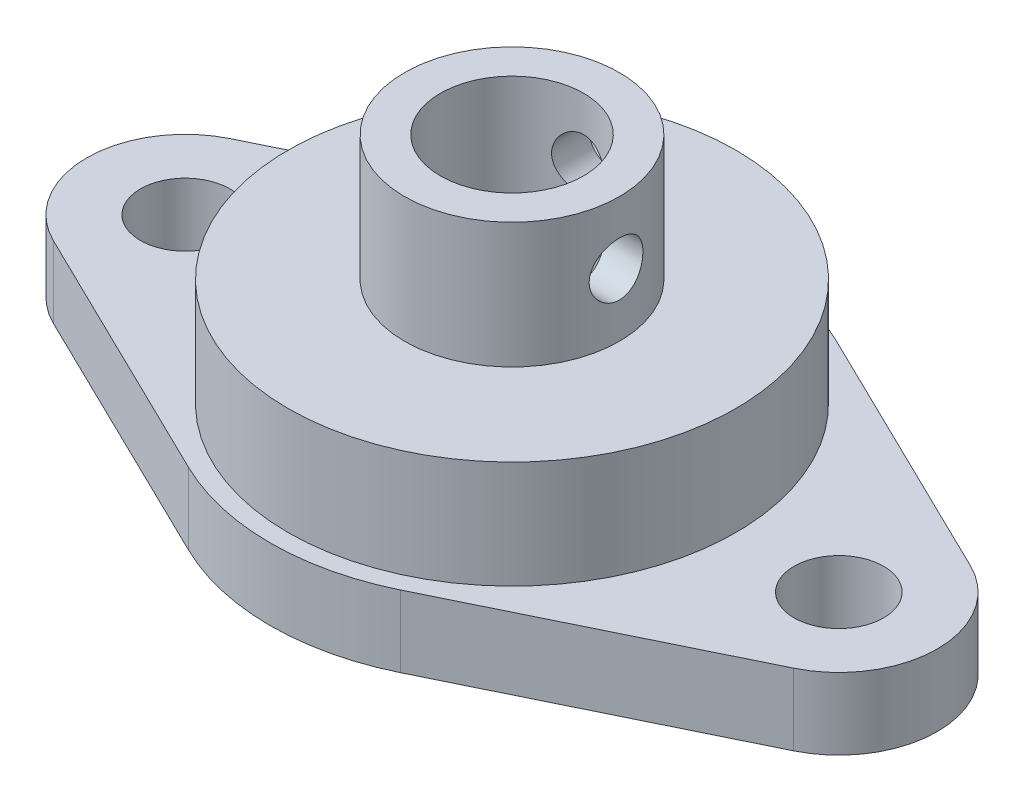
from build123d import *

# Parameters (mm, degrees)
SKETCH1_R           = 2.5
SKETCH1_R_2         = 4
BOSS_EXTRUDE1_DEPTH = 4
SKETCH2_R           = 12.5
SKETCH2_R_2         = 4
BOSS_EXTRUDE2_DEPTH = 6
SKETCH3_R           = 6
SKETCH3_R_2         = 4
BOSS_EXTRUDE3_DEPTH = 7
SKETCH4_R           = 1.5
CUT_EXTRUDE1_DEPTH  = 33.176272314


with BuildPart() as part:
    # Sketch1 → Boss-Extrude1 (new body)
    with BuildSketch(Plane(origin=(0, 0, 0), x_dir=(1, 0, 0), z_dir=(0, 1, 0))):
        with BuildLine():
            Line((-20.660958904, 4.943407445), (-5.917808219, 12.133818273))
            ThreePointArc((-5.917808219, 12.133818273), (0, 13.5), (5.917808219, 12.133818273))
            Line((5.917808219, 12.133818273), (20.660958904, 4.943407445))
            ThreePointArc((20.660958904, 4.943407445), (23.75, 0), (20.660958904, -4.943407445))
            Line((20.660958904, -4.943407445), (5.917808219, -12.133818273))
            ThreePointArc((5.917808219, -12.133818273), (0, -13.5), (-5.917808219, -12.133818273))
            Line((-5.917808219, -12.133818273), (-20.660958904, -4.943407445))
            ThreePointArc((-20.660958904, -4.943407445), (-23.75, 0), (-20.660958904, 4.943407445))
        make_face()
        with Locations(Location((18.25, 0, 0), (0, 0, 270))):
            Circle(SKETCH1_R, mode=Mode.SUBTRACT)
        with Locations(Location((-18.25, 0, 0), (0, 0, 90))):
            Circle(SKETCH1_R, mode=Mode.SUBTRACT)
        with Locations(Location((0, 0, 0), (0, 0, 270))):
            Circle(SKETCH1_R_2, mode=Mode.SUBTRACT)
    extrude(amount=BOSS_EXTRUDE1_DEPTH)

    # Sketch2 → Boss-Extrude2 (add)
    with BuildSketch(Plane(origin=(0, 4, 0), x_dir=(1, 0, 0), z_dir=(0, 1, 0))):
        with Locations(Location((0, 0, 0), (0, 0, 270))):
            Circle(SKETCH2_R)
        with Locations(Location((0, 0, 0), (0, 0, 270))):
            Circle(SKETCH2_R_2, mode=Mode.SUBTRACT)
    extrude(amount=BOSS_EXTRUDE2_DEPTH)

    # Sketch3 → Boss-Extrude3 (add)
    with BuildSketch(Plane(origin=(0, 10, 0), x_dir=(1, 0, 0), z_dir=(0, 1, 0))):
        with Locations(Location((0, 0, 0), (0, 0, 270))):
            Circle(SKETCH3_R)
        with Locations(Location((0, 0, 0), (0, 0, 270))):
            Circle(SKETCH3_R_2, mode=Mode.SUBTRACT)
    extrude(amount=BOSS_EXTRUDE3_DEPTH)

    # Sketch4 → Cut-Extrude1 (cut, through all)
    with BuildSketch(Plane.XY):
        with Locations(Location((0, 13.5, 0), (0, 0, 90))):
            Circle(SKETCH4_R)
    cut_extrude1 = extrude(amount=-CUT_EXTRUDE1_DEPTH, mode=Mode.SUBTRACT)

    # Mirror1: Cut-Extrude1 across plane
    add(cut_extrude1.mirror(Plane(origin=(0, 0, 0), x_dir=(-0.7071067811865478, 0, 0.7071067811865472), z_dir=(0.7071067811865475, 0, 0.7071067811865477))), mode=Mode.SUBTRACT)


solid = part.part
